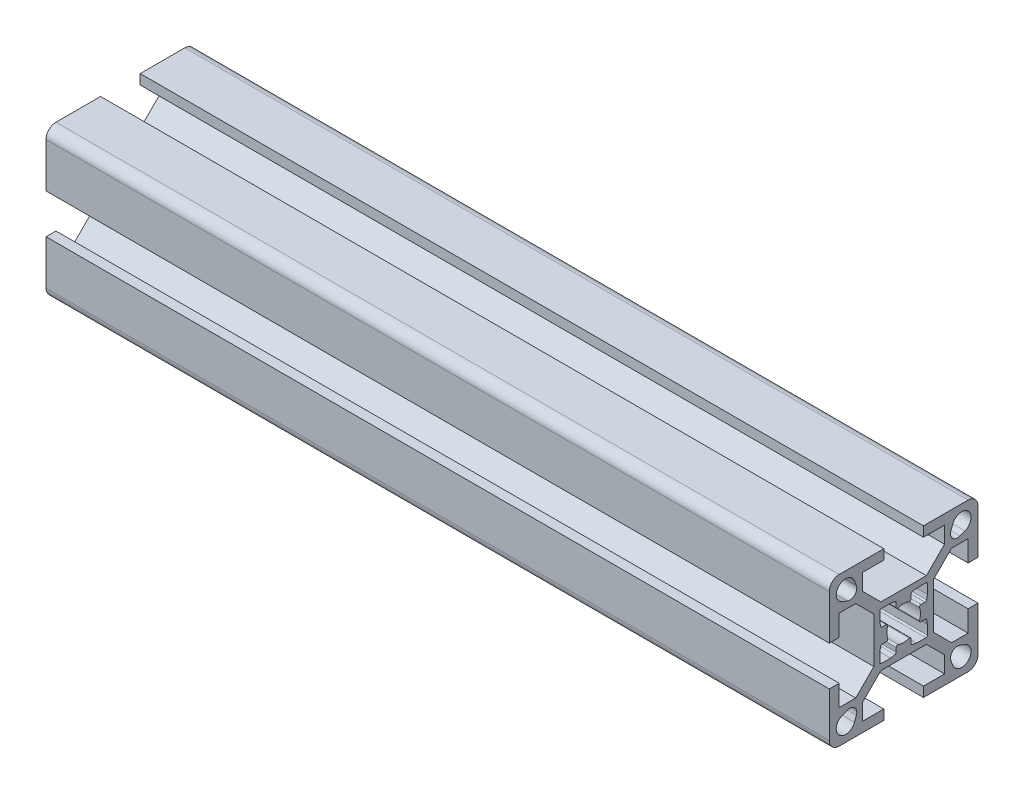
from build123d import *

# Parameters (mm, degrees)
BOSS_EXTRUDE1_DEPTH = 158


with BuildPart() as part:
    # Sketch1 → Boss-Extrude1 (new body)
    with BuildSketch(Plane(origin=(0, 0, 0), x_dir=(0, 0, -1), z_dir=(1, 0, 0))):
        with BuildLine():
            Line((-15, 13), (-15, 4))
            Line((-15, 4), (-13, 4))
            Line((-13, 4), (-13, 8.25))
            Line((-13, 8.25), (-9.664213562, 8.25))
            Line((-9.664213562, 8.25), (-6, 4.585786438))
            Line((-6, 4.585786438), (-6, -4.585786438))
            Line((-6, -4.585786438), (-9.664213562, -8.25))
            Line((-9.664213562, -8.25), (-13, -8.25))
            Line((-13, -8.25), (-13, -4))
            Line((-13, -4), (-15, -4))
            Line((-15, -4), (-15, -13))
            ThreePointArc((-15, -13), (-14.414213562, -14.414213562), (-13, -15))
            Line((-13, -15), (-4, -15))
            Line((-4, -15), (-4, -13))
            Line((-4, -13), (-8.25, -13))
            Line((-8.25, -13), (-8.25, -9.664213562))
            Line((-8.25, -9.664213562), (-4.585786438, -6))
            Line((-4.585786438, -6), (4.585786438, -6))
            Line((4.585786438, -6), (8.25, -9.664213562))
            Line((8.25, -9.664213562), (8.25, -13))
            Line((8.25, -13), (4, -13))
            Line((4, -13), (4, -15))
            Line((4, -15), (13, -15))
            ThreePointArc((13, -15), (14.414213562, -14.414213562), (15, -13))
            Line((15, -13), (15, -4))
            Line((15, -4), (13, -4))
            Line((13, -4), (13, -8.25))
            Line((13, -8.25), (9.664213562, -8.25))
            Line((9.664213562, -8.25), (6, -4.585786438))
            Line((6, -4.585786438), (6, 4.585786438))
            Line((6, 4.585786438), (9.664213562, 8.25))
            Line((9.664213562, 8.25), (13, 8.25))
            Line((13, 8.25), (13, 4))
            Line((13, 4), (15, 4))
            Line((15, 4), (15, 13))
            ThreePointArc((15, 13), (14.414213562, 14.414213562), (13, 15))
            Line((13, 15), (4, 15))
            Line((4, 15), (4, 13))
            Line((4, 13), (8.25, 13))
            Line((8.25, 13), (8.25, 9.664213562))
            Line((8.25, 9.664213562), (4.585786438, 6))
            Line((4.585786438, 6), (-4.585786438, 6))
            Line((-4.585786438, 6), (-8.25, 9.664213562))
            Line((-8.25, 9.664213562), (-8.25, 13))
            Line((-8.25, 13), (-4, 13))
            Line((-4, 13), (-4, 15))
            Line((-4, 15), (-13, 15))
            ThreePointArc((-13, 15), (-14.414213562, 14.414213562), (-15, 13))
        make_face()
        with BuildLine():
            Line((-9.539070071, 11.338915743), (-9.918883282, 12.361530981))
            ThreePointArc((-9.918883282, 12.361530981), (-13.043502884, 13.043502884), (-12.361530981, 9.918883282))
            Line((-12.361530981, 9.918883282), (-11.338915743, 9.539070071))
            ThreePointArc((-11.338915743, 9.539070071), (-9.861522369, 9.861522369), (-9.539070071, 11.338915743))
        make_face(mode=Mode.SUBTRACT)
        with BuildLine():
            Line((9.918883282, 12.361530981), (9.539070071, 11.338915743))
            ThreePointArc((9.539070071, 11.338915743), (9.861522369, 9.861522369), (11.338915743, 9.539070071))
            Line((11.338915743, 9.539070071), (12.361530981, 9.918883282))
            ThreePointArc((12.361530981, 9.918883282), (13.043502884, 13.043502884), (9.918883282, 12.361530981))
        make_face(mode=Mode.SUBTRACT)
        with BuildLine():
            Line((12.361530981, -9.918883282), (11.338915743, -9.539070071))
            ThreePointArc((11.338915743, -9.539070071), (9.861522369, -9.861522369), (9.539070071, -11.338915743))
            Line((9.539070071, -11.338915743), (9.918883282, -12.361530981))
            ThreePointArc((9.918883282, -12.361530981), (13.043502884, -13.043502884), (12.361530981, -9.918883282))
        make_face(mode=Mode.SUBTRACT)
        with BuildLine():
            Line((-11.338915743, -9.539070071), (-12.361530981, -9.918883282))
            ThreePointArc((-12.361530981, -9.918883282), (-13.043502884, -13.043502884), (-9.918883282, -12.361530981))
            Line((-9.918883282, -12.361530981), (-9.539070071, -11.338915743))
            ThreePointArc((-9.539070071, -11.338915743), (-9.861522369, -9.861522369), (-11.338915743, -9.539070071))
        make_face(mode=Mode.SUBTRACT)
        with BuildLine():
            Line((-4.8, -2.644433572), (-4.8, -4.5))
            ThreePointArc((-4.8, -4.5), (-4.712132034, -4.712132034), (-4.5, -4.8))
            Line((-4.5, -4.8), (-2.644433572, -4.8))
            ThreePointArc((-2.644433572, -4.8), (-2.615679847, -4.79861886), (-2.587190874, -4.794488155))
            Line((-2.587190874, -4.794488155), (-1.742757301, -4.630346896))
            ThreePointArc((-1.742757301, -4.630346896), (-1.568512625, -4.526682207), (-1.5, -4.335858741))
            Line((-1.5, -4.335858741), (-1.5, -3.5))
            ThreePointArc((-1.5, -3.5), (-1.374371458, -3.255879959), (-1.102702703, -3.216216216))
            ThreePointArc((-1.102702703, -3.216216216), (0, -3.4), (1.102702703, -3.216216216))
            ThreePointArc((1.102702703, -3.216216216), (1.374371458, -3.255879959), (1.5, -3.5))
            Line((1.5, -3.5), (1.5, -4.335858741))
            ThreePointArc((1.5, -4.335858741), (1.568512625, -4.526682207), (1.742757301, -4.630346896))
            Line((1.742757301, -4.630346896), (2.587190874, -4.794488155))
            ThreePointArc((2.587190874, -4.794488155), (2.615679847, -4.79861886), (2.644433572, -4.8))
            Line((2.644433572, -4.8), (4.5, -4.8))
            ThreePointArc((4.5, -4.8), (4.712132034, -4.712132034), (4.8, -4.5))
            Line((4.8, -4.5), (4.8, -2.644433572))
            ThreePointArc((4.8, -2.644433572), (4.79861886, -2.615679847), (4.794488155, -2.587190874))
            Line((4.794488155, -2.587190874), (4.630346896, -1.742757301))
            ThreePointArc((4.630346896, -1.742757301), (4.526682207, -1.568512625), (4.335858741, -1.5))
            Line((4.335858741, -1.5), (3.5, -1.5))
            ThreePointArc((3.5, -1.5), (3.255879959, -1.374371458), (3.216216216, -1.102702703))
            ThreePointArc((3.216216216, -1.102702703), (3.4, 0), (3.216216216, 1.102702703))
            ThreePointArc((3.216216216, 1.102702703), (3.255879959, 1.374371458), (3.5, 1.5))
            Line((3.5, 1.5), (4.335858741, 1.5))
            ThreePointArc((4.335858741, 1.5), (4.526682207, 1.568512625), (4.630346896, 1.742757301))
            Line((4.630346896, 1.742757301), (4.794488155, 2.587190874))
            ThreePointArc((4.794488155, 2.587190874), (4.79861886, 2.615679847), (4.8, 2.644433572))
            Line((4.8, 2.644433572), (4.8, 4.5))
            ThreePointArc((4.8, 4.5), (4.712132034, 4.712132034), (4.5, 4.8))
            Line((4.5, 4.8), (2.644433572, 4.8))
            ThreePointArc((2.644433572, 4.8), (2.615679847, 4.79861886), (2.587190874, 4.794488155))
            Line((2.587190874, 4.794488155), (1.742757301, 4.630346896))
            ThreePointArc((1.742757301, 4.630346896), (1.568512625, 4.526682207), (1.5, 4.335858741))
            Line((1.5, 4.335858741), (1.5, 3.5))
            ThreePointArc((1.5, 3.5), (1.374371458, 3.255879959), (1.102702703, 3.216216216))
            ThreePointArc((1.102702703, 3.216216216), (0, 3.4), (-1.102702703, 3.216216216))
            ThreePointArc((-1.102702703, 3.216216216), (-1.374371458, 3.255879959), (-1.5, 3.5))
            Line((-1.5, 3.5), (-1.5, 4.335858741))
            ThreePointArc((-1.5, 4.335858741), (-1.568512625, 4.526682207), (-1.742757301, 4.630346896))
            Line((-1.742757301, 4.630346896), (-2.587190874, 4.794488155))
            ThreePointArc((-2.587190874, 4.794488155), (-2.615679847, 4.79861886), (-2.644433572, 4.8))
            Line((-2.644433572, 4.8), (-4.5, 4.8))
            ThreePointArc((-4.5, 4.8), (-4.712132034, 4.712132034), (-4.8, 4.5))
            Line((-4.8, 4.5), (-4.8, 2.644433572))
            ThreePointArc((-4.8, 2.644433572), (-4.79861886, 2.615679847), (-4.794488155, 2.587190874))
            Line((-4.794488155, 2.587190874), (-4.630346896, 1.742757301))
            ThreePointArc((-4.630346896, 1.742757301), (-4.526682207, 1.568512625), (-4.335858741, 1.5))
            Line((-4.335858741, 1.5), (-3.5, 1.5))
            ThreePointArc((-3.5, 1.5), (-3.255879959, 1.374371458), (-3.216216216, 1.102702703))
            ThreePointArc((-3.216216216, 1.102702703), (-3.4, 0), (-3.216216216, -1.102702703))
            ThreePointArc((-3.216216216, -1.102702703), (-3.255879959, -1.374371458), (-3.5, -1.5))
            Line((-3.5, -1.5), (-4.335858741, -1.5))
            ThreePointArc((-4.335858741, -1.5), (-4.526682207, -1.568512625), (-4.630346896, -1.742757301))
            Line((-4.630346896, -1.742757301), (-4.794488155, -2.587190874))
            ThreePointArc((-4.794488155, -2.587190874), (-4.79861886, -2.615679847), (-4.8, -2.644433572))
        make_face(mode=Mode.SUBTRACT)
    extrude(amount=BOSS_EXTRUDE1_DEPTH)


solid = part.part
